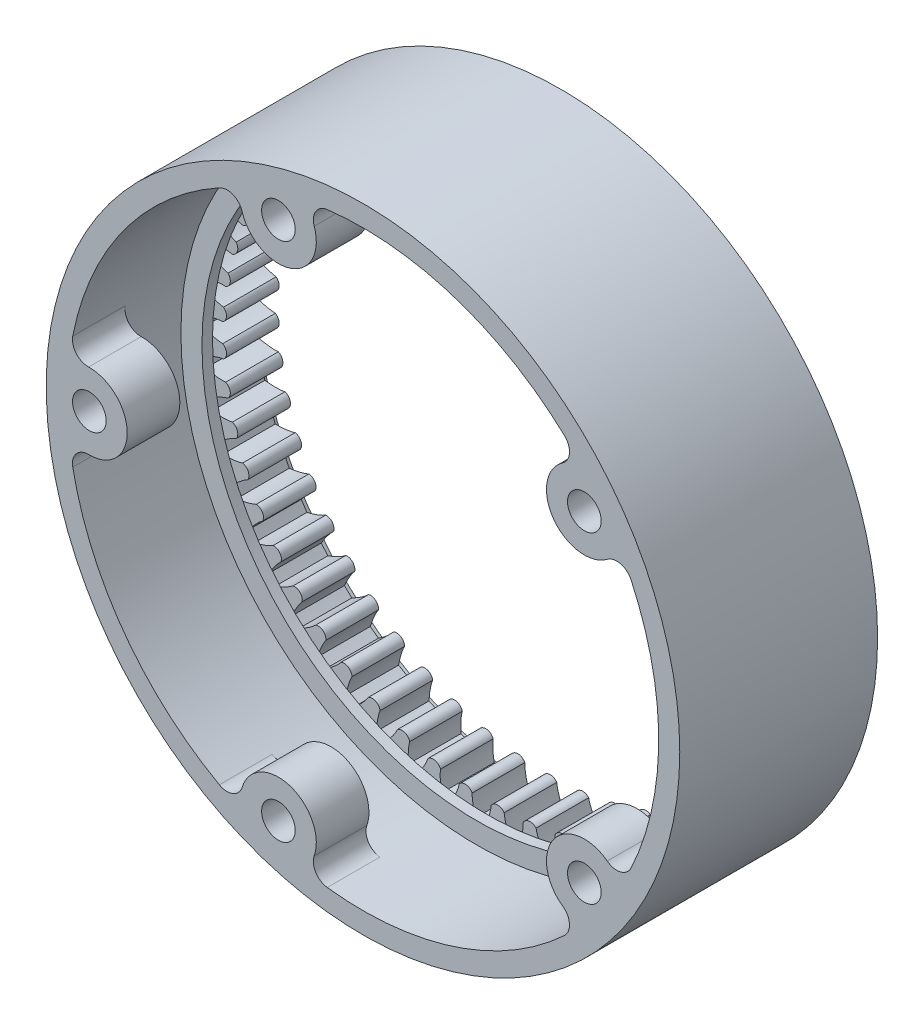
from build123d import *
from build123d.topology import SkipClean

# Parameters (mm, degrees)
BOSS_EXTRUDE1_DEPTH      = 1.9
BOSS_EXTRUDE2_DEPTH      = 12.9
SKETCH3_R                = 29.000000007
CUT_EXTRUDE1_DEPTH       = 1
CUT_EXTRUDE2_DEPTH       = 5
SKETCH5_R                = 28.100000003
CUT_EXTRUDE3_DEPTH       = 1
CUT_EXTRUDE4_START       = -12.9
CUT_EXTRUDE4_DEPTH       = 12.9
F_4_0_4_DIAMETER_HOLE1_D = 4
CUT_EXTRUDE5_DEPTH       = 56.8771868
CUT_EXTRUDE5_DEPTH_BACK  = 56.8771868
SKETCH11_R               = 2
BOSS_EXTRUDE3_START      = 4
SKETCH12_R               = 30.100000003
SKETCH12_R_2             = 28.100000003
BOSS_EXTRUDE3_DEPTH      = 4
BOSS_EXTRUDE5_START      = -5
SKETCH13_R               = 1.6
BOSS_EXTRUDE5_DEPTH      = 5


with BuildPart() as part:
    # Sketch1 → Boss-Extrude1 (new body)
    with BuildSketch(Plane.XY.offset(15.8)):
        with BuildLine():
            Line((3.999999971, 29.833035408), (3.999999971, 34.100000028))
            ThreePointArc((3.999999971, 34.100000028), (-2.9e-08, 38.100000028), (-4.000000029, 34.100000028))
            Line((-4.000000029, 34.100000028), (-4.000000029, 29.833035408))
            ThreePointArc((-4.000000029, 29.833035408), (-21.283914146, 21.283914141), (-29.833035413, 4.000000025))
            Line((-29.833035413, 4.000000025), (-34.100000033, 4.000000025))
            ThreePointArc((-34.100000033, 4.000000025), (-38.100000033, 2.5e-08), (-34.100000033, -3.999999975))
            Line((-34.100000033, -3.999999975), (-29.833035413, -3.999999975))
            ThreePointArc((-29.833035413, -3.999999975), (-21.283914146, -21.283914092), (-4.000000029, -29.833035359))
            Line((-4.000000029, -29.833035359), (-4.000000029, -34.099999979))
            ThreePointArc((-4.000000029, -34.099999979), (-2.9e-08, -38.099999979), (3.999999971, -34.099999979))
            Line((3.999999971, -34.099999979), (3.999999971, -29.833035359))
            ThreePointArc((3.999999971, -29.833035359), (21.283914087, -21.283914092), (29.833035354, -3.999999975))
            Line((29.833035354, -3.999999975), (34.099999974, -3.999999975))
            ThreePointArc((34.099999974, -3.999999975), (38.099999974, 2.5e-08), (34.099999974, 4.000000025))
            Line((34.099999974, 4.000000025), (29.833035354, 4.000000025))
            ThreePointArc((29.833035354, 4.000000025), (21.283914087, 21.283914141), (3.999999971, 29.833035408))
        make_face()
    extrude(amount=-BOSS_EXTRUDE1_DEPTH)

    # Sketch2 → Boss-Extrude2 (add)
    with BuildSketch(Plane(origin=(0, 0, 13.9), x_dir=(-1, 0, 0), z_dir=(0, 0, -1))):
        with BuildLine():
            Line((-29.833035354, -3.999999975), (-34.099999974, -3.999999975))
            ThreePointArc((-34.099999974, -3.999999975), (-38.099999974, 2.5e-08), (-34.099999974, 4.000000025))
            Line((-34.099999974, 4.000000025), (-29.833035354, 4.000000025))
            ThreePointArc((-29.833035354, 4.000000025), (30.100000033, 2.5e-08), (-29.833035354, -3.999999975))
        make_face()
    extrude(amount=BOSS_EXTRUDE2_DEPTH)

    # Sketch3 → Cut-Extrude1 (cut)
    with BuildSketch(Plane(origin=(0, 0, 1), x_dir=(-1, 0, 0), z_dir=(0, 0, -1))):
        with Locations((-1.9e-08, 5.3e-08)):
            Circle(SKETCH3_R)
    extrude(amount=-CUT_EXTRUDE1_DEPTH, mode=Mode.SUBTRACT)

    # Sketch4 → Cut-Extrude2 (cut)
    with BuildSketch(Plane(origin=(0, 0, 2), x_dir=(-1, 0, 0), z_dir=(0, 0, -1))):
        with BuildLine():
            ThreePointArc((-27.995776094, 0.484140924), (-27.999958724, 0.000192017), (-27.99577621, -0.483756892))
            add(Edge.make_bspline(
                [(-27.99577621, -0.483756892), (-26.869576859, -0.895866137), (-26.124303598, -0.904954601)],
                knots=[1.565757093, 1.565757093, 1.565757093, 2.51489562, 2.51489562, 2.51489562], degree=2, weights=[1, 0.889489632, 1]))
            ThreePointArc((-26.124303598, -0.904954601), (-25.767762214, -1.500605385), (-26.052706637, -2.13363642))
            add(Edge.make_bspline(
                [(-26.052706637, -2.13363642), (-26.791892303, -2.229001641), (-27.862661821, -2.76924741)],
                knots=[3.768507227, 3.768507227, 3.768507227, 4.724135584, 4.724135584, 4.724135584], degree=2, weights=[1, 0.88800217, 1]))
            ThreePointArc((-27.862661821, -2.76924741), (-27.810633131, -3.250409602), (-27.750295859, -3.730600661))
            add(Edge.make_bspline(
                [(-27.750295859, -3.730600661), (-26.583868502, -4.009179606), (-25.842579405, -3.931685672)],
                knots=[1.565757092, 1.565757092, 1.565757092, 2.51489562, 2.51489562, 2.51489562], degree=2, weights=[1, 0.889489631, 1]))
            ThreePointArc((-25.842579405, -3.931685672), (-25.419297991, -4.481916951), (-25.628825304, -5.143747685))
            add(Edge.make_bspline(
                [(-25.628825304, -5.143747685), (-26.351941636, -5.324282298), (-27.352752288, -5.985183873)],
                knots=[3.768507227, 3.768507227, 3.768507227, 4.724135579, 4.724135579, 4.724135579], degree=2, weights=[1, 0.888002171, 1]))
            ThreePointArc((-27.352752288, -5.985183873), (-27.245215876, -6.457052456), (-27.129539803, -6.926991905))
            add(Edge.make_bspline(
                [(-27.129539803, -6.926991905), (-25.938658369, -7.068273248), (-25.2113781, -6.905244889)],
                knots=[1.565757093, 1.565757093, 1.565757093, 2.51489562, 2.51489562, 2.51489562], degree=2, weights=[1, 0.889489631, 1]))
            ThreePointArc((-25.2113781, -6.905244889), (-24.727080812, -7.402615728), (-24.858357517, -8.084296036))
            add(Edge.make_bspline(
                [(-24.858357517, -8.084296036), (-25.555625605, -8.347558621), (-26.472943144, -9.12017844)],
                knots=[3.768507227, 3.768507227, 3.768507227, 4.724135583, 4.724135583, 4.724135583], degree=2, weights=[1, 0.88800217, 1]))
            ThreePointArc((-26.472943144, -9.12017844), (-26.311353256, -9.576372201), (-26.141902703, -10.029704916))
            add(Edge.make_bspline(
                [(-26.141902703, -10.029704916), (-24.94267182, -10.031778069), (-24.239235598, -9.785419964)],
                knots=[1.565757095, 1.565757095, 1.565757095, 2.51489562, 2.51489562, 2.51489562], degree=2, weights=[1, 0.889489632, 1]))
            ThreePointArc((-24.239235598, -9.785419964), (-23.700471724, -10.223204275), (-23.75172253, -10.9155156))
            add(Edge.make_bspline(
                [(-23.75172253, -10.9155156), (-24.41371302, -11.257945982), (-25.235132299, -12.131835688)],
                knots=[0.626914573, 0.626914573, 0.626914573, 1.582542924, 1.582542924, 1.582542924], degree=2, weights=[1, 0.888002171, 1]))
            ThreePointArc((-25.235132299, -12.131835688), (-25.021674161, -12.56618539), (-24.800740656, -12.996780823))
            add(Edge.make_bspline(
                [(-24.800740656, -12.996780823), (-23.609377865, -12.85961775), (-22.939298457, -12.533261469)],
                knots=[1.565757092, 1.565757092, 1.565757092, 2.51489562, 2.51489562, 2.51489562], degree=2, weights=[1, 0.889489631, 1]))
            ThreePointArc((-22.939298457, -12.533261469), (-22.353353856, -12.905538972), (-22.323885683, -13.59911899))
            add(Edge.make_bspline(
                [(-22.323885683, -13.59911899), (-22.941646289, -14.016086385), (-23.656059022, -14.97942812)],
                knots=[0.626914573, 0.626914573, 0.626914573, 1.582542928, 1.582542928, 1.582542928], degree=2, weights=[1, 0.88800217, 1]))
            ThreePointArc((-23.656059022, -14.97942812), (-23.393619289, -15.386059927), (-23.124190579, -15.788095013))
            add(Edge.make_bspline(
                [(-23.124190579, -15.788095013), (-21.956807018, -15.51355061), (-21.329146099, -15.111609563)],
                knots=[1.565757095, 1.565757095, 1.565757095, 2.51489562, 2.51489562, 2.51489562], degree=2, weights=[1, 0.889489632, 1]))
            ThreePointArc((-21.329146099, -15.111609563), (-20.703944664, -15.413345841), (-20.59415602, -16.098815074))
            add(Edge.make_bspline(
                [(-20.59415602, -16.098815074), (-21.159332589, -16.584680714), (-21.75707757, -17.624446933)],
                knots=[0.626914573, 0.626914573, 0.626914573, 1.582542928, 1.582542928, 1.582542928], degree=2, weights=[1, 0.88800217, 1]))
            ThreePointArc((-21.75707757, -17.624446933), (-21.449205289, -17.997861847), (-21.134924934, -18.365899752))
            add(Edge.make_bspline(
                [(-21.134924934, -18.365899752), (-20.007307463, -17.95768676), (-19.43055307, -17.485596509)],
                knots=[1.565757093, 1.565757093, 1.565757093, 2.51489562, 2.51489562, 2.51489562], degree=2, weights=[1, 0.889489632, 1]))
            ThreePointArc((-19.43055307, -17.485596509), (-18.77454958, -17.712711099), (-18.585925166, -18.38079975))
            add(Edge.make_bspline(
                [(-18.585925166, -18.38079975), (-19.090874656, -18.928993135), (-19.563868409, -20.031122783)],
                knots=[0.626914573, 0.626914573, 0.626914573, 1.582542929, 1.582542929, 1.582542929], degree=2, weights=[1, 0.88800217, 1]))
            ThreePointArc((-19.563868409, -20.031122783), (-19.214727024, -20.36627101), (-18.859845128, -20.695334651))
            add(Edge.make_bspline(
                [(-18.859845128, -20.695334651), (-17.787242838, -20.158973451), (-17.269194585, -19.623118207)],
                knots=[1.565757093, 1.565757093, 1.565757093, 2.51489562, 2.51489562, 2.51489562], degree=2, weights=[1, 0.889489632, 1]))
            ThreePointArc((-17.269194585, -19.623118207), (-16.591260361, -19.772539773), (-16.326351, -20.414213089))
            add(Edge.make_bspline(
                [(-16.326351, -20.414213089), (-16.764244834, -21.017320845), (-17.10609093, -22.16690951)],
                knots=[0.626914573, 0.626914573, 0.626914573, 1.582542926, 1.582542926, 1.582542926], degree=2, weights=[1, 0.888002171, 1]))
            ThreePointArc((-17.10609093, -22.16690951), (-16.72040198, -22.459258743), (-16.329717711, -22.744898101))
            add(Edge.make_bspline(
                [(-16.329717711, -22.744898101), (-15.326635709, -22.087642058), (-14.874299309, -21.495268344)],
                knots=[1.565757092, 1.565757092, 1.565757092, 2.51489562, 2.51489562, 2.51489562], degree=2, weights=[1, 0.889489631, 1]))
            ThreePointArc((-14.874299309, -21.495268344), (-14.183602249, -21.564976214), (-13.845990385, -22.171556666))
            add(Edge.make_bspline(
                [(-13.845990385, -22.171556666), (-14.210906801, -22.821422793), (-14.416982357, -24.002924261)],
                knots=[0.626914573, 0.626914573, 0.626914573, 1.582542934, 1.582542934, 1.582542934], degree=2, weights=[1, 0.888002169, 1]))
            ThreePointArc((-14.416982357, -24.002924261), (-13.999961624, -24.248520979), (-13.578758317, -24.48687327))
            add(Edge.make_bspline(
                [(-13.578758317, -24.48687327), (-12.658761565, -23.717610645), (-12.278254093, -23.076729299)],
                knots=[1.565757096, 1.565757096, 1.565757096, 2.51489562, 2.51489562, 2.51489562], degree=2, weights=[1, 0.889489632, 1]))
            ThreePointArc((-12.278254093, -23.076729299), (-11.58413469, -23.065780795), (-11.178385944, -23.629065422))
            add(Edge.make_bspline(
                [(-11.178385944, -23.629065422), (-11.465390074, -24.316901597), (-11.532908272, -25.514338086)],
                knots=[0.626914573, 0.626914573, 0.626914573, 1.582542934, 1.582542934, 1.582542934], degree=2, weights=[1, 0.888002169, 1]))
            ThreePointArc((-11.532908272, -25.514338086), (-11.090195244, -25.709861015), (-10.644168951, -25.897702934))
            add(Edge.make_bspline(
                [(-10.644168951, -25.897702934), (-9.819698829, -25.026836683), (-9.516165995, -24.346114526)],
                knots=[4.707349745, 4.707349745, 4.707349745, 5.656488273, 5.656488273, 5.656488273], degree=2, weights=[1, 0.889489631, 1]))
            ThreePointArc((-9.516165995, -24.346114526), (-8.828011023, -24.254657708), (-8.359612451, -24.767029051))
            add(Edge.make_bspline(
                [(-8.359612451, -24.767029051), (-8.564823055, -25.48353347), (-8.492870828, -26.680711706)],
                knots=[0.626914573, 0.626914573, 0.626914573, 1.582542929, 1.582542929, 1.582542929], degree=2, weights=[1, 0.88800217, 1]))
            ThreePointArc((-8.492870828, -26.680711706), (-8.030452441, -26.823516733), (-7.565634903, -26.95830804))
            add(Edge.make_bspline(
                [(-7.565634903, -26.95830804), (-6.847840953, -25.997615136), (-6.625387518, -25.286257768)],
                knots=[4.707349744, 4.707349744, 4.707349744, 5.656488273, 5.656488273, 5.656488273], degree=2, weights=[1, 0.889489631, 1]))
            ThreePointArc((-6.625387518, -25.286257768), (-5.952503092, -25.115529432), (-5.427788982, -25.570058548))
            add(Edge.make_bspline(
                [(-5.427788982, -25.570058548), (-5.548430939, -26.305541718), (-5.337981318, -27.486271919)],
                knots=[0.626914573, 0.626914573, 0.626914573, 1.582542929, 1.582542929, 1.582542929], degree=2, weights=[1, 0.88800217, 1]))
            ThreePointArc((-5.337981318, -27.486271919), (-4.862110986, -27.574427852), (-4.384788062, -27.654345725))
            add(Edge.make_bspline(
                [(-4.384788062, -27.654345725), (-3.783377217, -26.616817891), (-3.645011483, -25.8844452)],
                knots=[4.707349746, 4.707349746, 4.707349746, 5.656488273, 5.656488273, 5.656488273], degree=2, weights=[1, 0.889489631, 1]))
            ThreePointArc((-3.645011483, -25.8844452), (-2.996497211, -25.636754154), (-2.422563419, -26.027294316))
            add(Edge.make_bspline(
                [(-2.422563419, -26.027294316), (-2.457005255, -26.771810088), (-2.110904208, -27.920124905)],
                knots=[0.626914573, 0.626914573, 0.626914573, 1.582542929, 1.582542929, 1.582542929], degree=2, weights=[1, 0.88800217, 1]))
            ThreePointArc((-2.110904208, -27.920124905), (-1.628017263, -27.952439585), (-1.144643927, -27.976403273))
            add(Edge.make_bspline(
                [(-1.144643927, -27.976403273), (-0.667749236, -26.876071293), (-0.615342362, -26.132587362)],
                knots=[4.707349744, 4.707349744, 4.707349744, 5.656488273, 5.656488273, 5.656488273], degree=2, weights=[1, 0.889489631, 1]))
            ThreePointArc((-0.615342362, -26.132587362), (3.1714e-05, -25.811283203), (0.615423716, -26.132553026))
            add(Edge.make_bspline(
                [(0.615423716, -26.132553026), (0.667647769, -26.876033102), (1.144719818, -27.976403545)],
                knots=[0.626914573, 0.626914573, 0.626914573, 1.582542933, 1.582542933, 1.582542933], degree=2, weights=[1, 0.888002169, 1]))
            ThreePointArc((1.144719818, -27.976403545), (1.62809316, -27.952439972), (2.110980112, -27.920125407))
            add(Edge.make_bspline(
                [(2.110980112, -27.920125407), (2.456909466, -26.771869384), (2.422648768, -26.027328559)],
                knots=[4.707349743, 4.707349743, 4.707349743, 5.656488273, 5.656488273, 5.656488273], degree=2, weights=[1, 0.889489631, 1]))
            ThreePointArc((2.422648768, -26.027328559), (2.996560767, -25.636756374), (3.645088859, -25.884411235))
            add(Edge.make_bspline(
                [(3.645088859, -25.884411235), (3.783272561, -26.616801322), (4.38486403, -27.654346769)],
                knots=[3.768507227, 3.768507227, 3.768507227, 4.724135582, 4.724135582, 4.724135582], degree=2, weights=[1, 0.88800217, 1]))
            ThreePointArc((4.38486403, -27.654346769), (4.862186973, -27.574429009), (5.338057325, -27.48627319))
            add(Edge.make_bspline(
                [(5.338057325, -27.48627319), (5.54834324, -26.305621317), (5.427878286, -25.570092234)],
                knots=[4.707349746, 4.707349746, 4.707349746, 5.656488273, 5.656488273, 5.656488273], degree=2, weights=[1, 0.889489631, 1]))
            ThreePointArc((5.427878286, -25.570092234), (5.952567035, -25.115533842), (6.625460986, -25.286224633))
            add(Edge.make_bspline(
                [(6.625460986, -25.286224633), (6.847735639, -25.997620412), (7.565711036, -26.958309842)],
                knots=[0.626914573, 0.626914573, 0.626914573, 1.582542931, 1.582542931, 1.582542931], degree=2, weights=[1, 0.88800217, 1]))
            ThreePointArc((7.565711036, -26.958309842), (8.030528607, -26.823518645), (8.492947027, -26.680713729))
            add(Edge.make_bspline(
                [(8.492947027, -26.680713729), (8.564745748, -25.483632296), (8.35970562, -24.767061725)],
                knots=[4.707349745, 4.707349745, 4.707349745, 5.656488273, 5.656488273, 5.656488273], degree=2, weights=[1, 0.889489631, 1]))
            ThreePointArc((8.35970562, -24.767061725), (8.828075603, -24.254664248), (9.516235677, -24.34608267))
            add(Edge.make_bspline(
                [(9.516235677, -24.34608267), (9.819595397, -25.026863733), (10.644245338, -25.897705468)],
                knots=[0.626914573, 0.626914573, 0.626914573, 1.582542925, 1.582542925, 1.582542925], degree=2, weights=[1, 0.888002171, 1]))
            ThreePointArc((10.644245338, -25.897705468), (11.090271675, -25.709863655), (11.532984749, -25.514340832))
            add(Edge.make_bspline(
                [(11.532984749, -25.514340832), (11.46532532, -24.317018313), (11.178482835, -23.629096642)],
                knots=[4.70734974, 4.70734974, 4.70734974, 5.656488273, 5.656488273, 5.656488273], degree=2, weights=[1, 0.88948963, 1]))
            ThreePointArc((11.178482835, -23.629096642), (11.584200151, -23.065789377), (12.278320164, -23.076699152))
            add(Edge.make_bspline(
                [(12.278320164, -23.076699152), (12.658662531, -23.717659103), (13.578835039, -24.486876503)],
                knots=[3.768507227, 3.768507227, 3.768507227, 4.72413558, 4.72413558, 4.72413558], degree=2, weights=[1, 0.888002171, 1]))
            ThreePointArc((13.578835039, -24.486876503), (14.000038402, -24.248524312), (14.417059194, -24.002927694))
            add(Edge.make_bspline(
                [(14.417059194, -24.002927694), (14.210856594, -22.821555821), (13.846090803, -22.17158601)],
                knots=[4.707349741, 4.707349741, 4.707349741, 5.656488273, 5.656488273, 5.656488273], degree=2, weights=[1, 0.88948963, 1]))
            ThreePointArc((13.846090803, -22.17158601), (14.183668822, -21.564986722), (14.874361991, -21.495240314))
            add(Edge.make_bspline(
                [(14.874361991, -21.495240314), (15.326543528, -22.087711269), (16.329794848, -22.744901989)],
                knots=[0.626914573, 0.626914573, 0.626914573, 1.582542936, 1.582542936, 1.582542936], degree=2, weights=[1, 0.888002169, 1]))
            ThreePointArc((16.329794848, -22.744901989), (16.720479184, -22.459262724), (17.106168203, -22.166913583))
            add(Edge.make_bspline(
                [(17.106168203, -22.166913583), (16.764210968, -21.017468385), (16.326454703, -20.414240161)],
                knots=[4.707349746, 4.707349746, 4.707349746, 5.656488273, 5.656488273, 5.656488273], degree=2, weights=[1, 0.889489631, 1]))
            ThreePointArc((16.326454703, -20.414240161), (16.591328262, -19.772552065), (17.269254147, -19.623092674))
            add(Edge.make_bspline(
                [(17.269254147, -19.623092674), (17.787159874, -20.15906248), (18.859922752, -20.695339142)],
                knots=[0.626914573, 0.626914573, 0.626914573, 1.582542928, 1.582542928, 1.582542928], degree=2, weights=[1, 0.88800217, 1]))
            ThreePointArc((18.859922752, -20.695339142), (19.214804726, -20.366275585), (19.56394619, -20.031127442))
            add(Edge.make_bspline(
                [(19.56394619, -20.031127442), (19.090858705, -18.929153193), (18.586031869, -18.380824183)],
                knots=[4.707349743, 4.707349743, 4.707349743, 5.656488273, 5.656488273, 5.656488273], degree=2, weights=[1, 0.889489631, 1]))
            ThreePointArc((18.586031869, -18.380824183), (18.774619006, -17.712725009), (19.430609823, -17.485573817))
            add(Edge.make_bspline(
                [(19.430609823, -17.485573817), (20.007235953, -17.957794402), (21.135003113, -18.365904784)],
                knots=[0.626914573, 0.626914573, 0.626914573, 1.582542934, 1.582542934, 1.582542934], degree=2, weights=[1, 0.888002169, 1]))
            ThreePointArc((21.135003113, -18.365904784), (21.449283555, -17.997866955), (21.757155925, -17.624452114))
            add(Edge.make_bspline(
                [(21.757155925, -17.624452114), (21.159335886, -16.584851126), (20.594265396, -16.098836538)],
                knots=[4.707349744, 4.707349744, 4.707349744, 5.656488273, 5.656488273, 5.656488273], degree=2, weights=[1, 0.889489631, 1]))
            ThreePointArc((20.594265396, -16.098836538), (20.704015794, -15.413361181), (21.329200391, -15.111590019))
            add(Edge.make_bspline(
                [(21.329200391, -15.111590019), (21.956749046, -15.51367541), (23.124269372, -15.788100519)],
                knots=[0.626914573, 0.626914573, 0.626914573, 1.582542934, 1.582542934, 1.582542934], degree=2, weights=[1, 0.888002169, 1]))
            ThreePointArc((23.124269372, -15.788100519), (23.393698177, -15.386065498), (23.656138007, -14.979433754))
            add(Edge.make_bspline(
                [(23.656138007, -14.979433754), (22.941669905, -14.016264846), (22.323997369, -13.599137195)],
                knots=[4.707349742, 4.707349742, 4.707349742, 5.656488273, 5.656488273, 5.656488273], degree=2, weights=[1, 0.889489631, 1]))
            ThreePointArc((22.323997369, -13.599137195), (22.353426843, -12.905555534), (22.939350672, -12.533245339))
            add(Edge.make_bspline(
                [(22.939350672, -12.533245339), (23.609335332, -12.859758019), (24.800820114, -12.996786728)],
                knots=[0.626914573, 0.626914573, 0.626914573, 1.582542928, 1.582542928, 1.582542928], degree=2, weights=[1, 0.88800217, 1]))
            ThreePointArc((24.800820114, -12.996786728), (25.02175372, -12.566191349), (25.235211962, -12.131841699))
            add(Edge.make_bspline(
                [(25.235211962, -12.131841699), (24.413757752, -11.258130078), (23.751836133, -10.9155303)],
                knots=[4.707349744, 4.707349744, 4.707349744, 5.656488273, 5.656488273, 5.656488273], degree=2, weights=[1, 0.889489631, 1]))
            ThreePointArc((23.751836133, -10.9155303), (23.700546699, -10.223221836), (24.239286145, -9.785407464))
            add(Edge.make_bspline(
                [(24.239286145, -9.785407464), (24.942646417, -10.031931912), (26.141982867, -10.02971114)],
                knots=[0.626914573, 0.626914573, 0.626914573, 1.582542927, 1.582542927, 1.582542927], degree=2, weights=[1, 0.888002171, 1]))
            ThreePointArc((26.141982867, -10.02971114), (26.311433527, -9.576378467), (26.473023523, -9.120184745))
            add(Edge.make_bspline(
                [(26.473023523, -9.120184745), (25.555691965, -8.347745863), (24.858472616, -8.084307032)],
                knots=[4.707349744, 4.707349744, 4.707349744, 5.656488273, 5.656488273, 5.656488273], degree=2, weights=[1, 0.889489631, 1]))
            ThreePointArc((24.858472616, -8.084307032), (24.727157876, -7.40263405), (25.211427413, -6.90523619))
            add(Edge.make_bspline(
                [(25.211427413, -6.90523619), (25.938651555, -7.068438584), (27.129620705, -6.926998365)],
                knots=[0.626914573, 0.626914573, 0.626914573, 1.58254293, 1.58254293, 1.58254293], degree=2, weights=[1, 0.88800217, 1]))
            ThreePointArc((27.129620705, -6.926998365), (27.245275398, -6.457149626), (27.352793571, -5.985372466))
            add(Edge.make_bspline(
                [(27.352793571, -5.985372466), (26.351997667, -5.324659939), (25.628915728, -5.143946223)],
                knots=[4.707356987, 4.707356987, 4.707356987, 5.656488273, 5.656488273, 5.656488273], degree=2, weights=[1, 0.889491286, 1]))
            ThreePointArc((25.628915728, -5.143946223), (25.419351488, -4.482127181), (25.8426022, -3.931872286))
            add(Edge.make_bspline(
                [(25.8426022, -3.931872286), (26.583855755, -4.009545593), (27.75035179, -3.730798663)],
                knots=[0.626914573, 0.626914573, 0.626914573, 1.582542928, 1.582542928, 1.582542928], degree=2, weights=[1, 0.88800217, 1]))
            ThreePointArc((27.75035179, -3.730798663), (27.810703699, -3.250512131), (27.862743714, -2.769254047))
            add(Edge.make_bspline(
                [(27.862743714, -2.769254047), (26.792002281, -2.229187571), (26.052823394, -2.133639615)],
                knots=[4.707349743, 4.707349743, 4.707349743, 5.656488273, 5.656488273, 5.656488273], degree=2, weights=[1, 0.889489631, 1]))
            ThreePointArc((26.052823394, -2.133639615), (25.767843651, -1.500624479), (26.1243518, -0.904953802))
            add(Edge.make_bspline(
                [(26.1243518, -0.904953802), (26.869610583, -0.896047625), (27.995858647, -0.483763558)],
                knots=[0.626914573, 0.626914573, 0.626914573, 1.58254293, 1.58254293, 1.58254293], degree=2, weights=[1, 0.88800217, 1]))
            ThreePointArc((27.995858647, -0.483763558), (28.000041276, 0.000185348), (27.995858761, 0.484134255))
            add(Edge.make_bspline(
                [(27.995858761, 0.484134255), (26.869659407, 0.896243501), (26.124386144, 0.905331966)],
                knots=[1.565757091, 1.565757091, 1.565757091, 2.51489562, 2.51489562, 2.51489562], degree=2, weights=[1, 0.889489631, 1]))
            ThreePointArc((26.124386144, 0.905331966), (25.76784476, 1.50098275), (26.052789183, 2.134013785))
            add(Edge.make_bspline(
                [(26.052789183, 2.134013785), (26.791974849, 2.229379006), (27.862744367, 2.769624775)],
                knots=[0.626914573, 0.626914573, 0.626914573, 1.58254293, 1.58254293, 1.58254293], degree=2, weights=[1, 0.88800217, 1]))
            ThreePointArc((27.862744367, 2.769624775), (27.810715676, 3.250786965), (27.750378403, 3.730978023))
            add(Edge.make_bspline(
                [(27.750378403, 3.730978023), (26.583951043, 4.009556969), (25.842661945, 3.932063035)],
                knots=[4.707349744, 4.707349744, 4.707349744, 5.656488273, 5.656488273, 5.656488273], degree=2, weights=[1, 0.889489631, 1]))
            ThreePointArc((25.842661945, 3.932063035), (25.419380531, 4.482294314), (25.628907844, 5.144125048))
            add(Edge.make_bspline(
                [(25.628907844, 5.144125048), (26.352024175, 5.324659661), (27.352834827, 5.985561235)],
                knots=[0.626914573, 0.626914573, 0.626914573, 1.582542926, 1.582542926, 1.582542926], degree=2, weights=[1, 0.888002171, 1]))
            ThreePointArc((27.352834827, 5.985561235), (27.245298415, 6.457429817), (27.129622341, 6.927369264))
            add(Edge.make_bspline(
                [(27.129622341, 6.927369264), (25.938740904, 7.068650608), (25.211460634, 6.905622249)],
                knots=[4.707349744, 4.707349744, 4.707349744, 5.656488273, 5.656488273, 5.656488273], degree=2, weights=[1, 0.889489631, 1]))
            ThreePointArc((25.211460634, 6.905622249), (24.727163345, 7.402993087), (24.858440051, 8.084673395))
            add(Edge.make_bspline(
                [(24.858440051, 8.084673395), (25.555708139, 8.34793598), (26.473025677, 9.120555799)],
                knots=[0.626914573, 0.626914573, 0.626914573, 1.582542929, 1.582542929, 1.582542929], degree=2, weights=[1, 0.88800217, 1]))
            ThreePointArc((26.473025677, 9.120555799), (26.311435789, 9.576749558), (26.141985236, 10.03008227))
            add(Edge.make_bspline(
                [(26.141985236, 10.03008227), (24.942754351, 10.032155424), (24.239318127, 9.785797318)],
                knots=[4.707349746, 4.707349746, 4.707349746, 5.656488273, 5.656488273, 5.656488273], degree=2, weights=[1, 0.889489631, 1]))
            ThreePointArc((24.239318127, 9.785797318), (23.700554253, 10.22358163), (23.751805059, 10.915892954))
            add(Edge.make_bspline(
                [(23.751805059, 10.915892954), (24.413795549, 11.258323336), (25.235214828, 12.132213043)],
                knots=[3.768507227, 3.768507227, 3.768507227, 4.724135578, 4.724135578, 4.724135578], degree=2, weights=[1, 0.888002171, 1]))
            ThreePointArc((25.235214828, 12.132213043), (25.02175669, 12.566562742), (24.800823186, 12.997158172))
            add(Edge.make_bspline(
                [(24.800823186, 12.997158172), (23.609460392, 12.859995099), (22.939380982, 12.533638818)],
                knots=[4.707349743, 4.707349743, 4.707349743, 5.656488273, 5.656488273, 5.656488273], degree=2, weights=[1, 0.889489631, 1]))
            ThreePointArc((22.939380982, 12.533638818), (22.353436381, 12.90591632), (22.323968208, 13.599496339))
            add(Edge.make_bspline(
                [(22.323968208, 13.599496339), (22.941728814, 14.016463734), (23.656141547, 14.979805469)],
                knots=[3.768507227, 3.768507227, 3.768507227, 4.724135582, 4.724135582, 4.724135582], degree=2, weights=[1, 0.88800217, 1]))
            ThreePointArc((23.656141547, 14.979805469), (23.393701815, 15.386437273), (23.124273106, 15.788472356))
            add(Edge.make_bspline(
                [(23.124273106, 15.788472356), (21.956889542, 15.513927953), (21.329228621, 15.111986904)],
                knots=[1.565757094, 1.565757094, 1.565757094, 2.51489562, 2.51489562, 2.51489562], degree=2, weights=[1, 0.889489632, 1]))
            ThreePointArc((21.329228621, 15.111986904), (20.704027187, 15.413723183), (20.594238542, 16.099192416))
            add(Edge.make_bspline(
                [(20.594238542, 16.099192416), (21.159415112, 16.585058055), (21.757160093, 17.624824274)],
                knots=[3.768507227, 3.768507227, 3.768507227, 4.724135582, 4.724135582, 4.724135582], degree=2, weights=[1, 0.88800217, 1]))
            ThreePointArc((21.757160093, 17.624824274), (21.449287813, 17.998239186), (21.13500746, 18.366277088))
            add(Edge.make_bspline(
                [(21.13500746, 18.366277088), (20.007389986, 17.958064096), (19.430635592, 17.485973844)],
                knots=[4.707349745, 4.707349745, 4.707349745, 5.656488273, 5.656488273, 5.656488273], degree=2, weights=[1, 0.889489631, 1]))
            ThreePointArc((19.430635592, 17.485973844), (18.774632102, 17.713088434), (18.586007688, 18.381177085))
            add(Edge.make_bspline(
                [(18.586007688, 18.381177085), (19.090957178, 18.92937047), (19.563950931, 20.031500118)],
                knots=[3.768507227, 3.768507227, 3.768507227, 4.724135583, 4.724135583, 4.724135583], degree=2, weights=[1, 0.88800217, 1]))
            ThreePointArc((19.563950931, 20.031500118), (19.214809548, 20.366648342), (18.859927654, 20.695711981))
            add(Edge.make_bspline(
                [(18.859927654, 20.695711981), (17.787325362, 20.15935078), (17.269277108, 19.623495536)],
                knots=[4.707349744, 4.707349744, 4.707349744, 5.656488273, 5.656488273, 5.656488273], degree=2, weights=[1, 0.889489631, 1]))
            ThreePointArc((17.269277108, 19.623495536), (16.591342884, 19.772917101), (16.326433523, 20.414590418))
            add(Edge.make_bspline(
                [(16.326433523, 20.414590418), (16.764327358, 21.017698173), (17.106173453, 22.167286838)],
                knots=[3.768507227, 3.768507227, 3.768507227, 4.724135588, 4.724135588, 4.724135588], degree=2, weights=[1, 0.888002169, 1]))
            ThreePointArc((17.106173453, 22.167286838), (16.720484505, 22.459636069), (16.329800239, 22.745275424))
            add(Edge.make_bspline(
                [(16.329800239, 22.745275424), (15.326718235, 22.08801938), (14.874381835, 21.495645666)],
                knots=[4.707349744, 4.707349744, 4.707349744, 5.656488273, 5.656488273, 5.656488273], degree=2, weights=[1, 0.889489631, 1]))
            ThreePointArc((14.874381835, 21.495645666), (14.183684775, 21.565353536), (13.846072911, 22.171933988))
            add(Edge.make_bspline(
                [(13.846072911, 22.171933988), (14.210989327, 22.821800115), (14.417064883, 24.003301583)],
                knots=[3.768507227, 3.768507227, 3.768507227, 4.724135587, 4.724135587, 4.724135587], degree=2, weights=[1, 0.888002169, 1]))
            ThreePointArc((14.417064883, 24.003301583), (14.000044152, 24.248898299), (13.578840848, 24.487250588))
            add(Edge.make_bspline(
                [(13.578840848, 24.487250588), (12.658844095, 23.717987961), (12.278336623, 23.077106615)],
                knots=[4.707349748, 4.707349748, 4.707349748, 5.656488273, 5.656488273, 5.656488273], degree=2, weights=[1, 0.889489632, 1]))
            ThreePointArc((12.278336623, 23.077106615), (11.58421722, 23.066158111), (11.178468474, 23.629442738))
            add(Edge.make_bspline(
                [(11.178468474, 23.629442738), (11.465472603, 24.317278913), (11.532990802, 25.514715402)],
                knots=[3.768507227, 3.768507227, 3.768507227, 4.724135588, 4.724135588, 4.724135588], degree=2, weights=[1, 0.888002169, 1]))
            ThreePointArc((11.532990802, 25.514715402), (11.090277777, 25.710238329), (10.644251487, 25.898080246))
            add(Edge.make_bspline(
                [(10.644251487, 25.898080246), (9.819781364, 25.027213995), (9.51624853, 24.346491838)],
                knots=[1.56575709, 1.56575709, 1.56575709, 2.51489562, 2.51489562, 2.51489562], degree=2, weights=[1, 0.889489631, 1]))
            ThreePointArc((9.51624853, 24.346491838), (8.828093558, 24.25503502), (8.359694986, 24.767406362))
            add(Edge.make_bspline(
                [(8.359694986, 24.767406362), (8.56490559, 25.483910782), (8.492953363, 26.681089018)],
                knots=[3.768507227, 3.768507227, 3.768507227, 4.724135583, 4.724135583, 4.724135583], degree=2, weights=[1, 0.88800217, 1]))
            ThreePointArc((8.492953363, 26.681089018), (8.030534979, 26.823894044), (7.565717444, 26.958685349))
            add(Edge.make_bspline(
                [(7.565717444, 26.958685349), (6.847923494, 25.997992445), (6.625470059, 25.286635076)],
                knots=[1.56575709, 1.56575709, 1.56575709, 2.51489562, 2.51489562, 2.51489562], degree=2, weights=[1, 0.889489631, 1]))
            ThreePointArc((6.625470059, 25.286635076), (5.952585633, 25.11590674), (5.427871522, 25.570435856))
            add(Edge.make_bspline(
                [(5.427871522, 25.570435856), (5.54851348, 26.305919026), (5.338063858, 27.486649227)],
                knots=[3.768507227, 3.768507227, 3.768507227, 4.724135583, 4.724135583, 4.724135583], degree=2, weights=[1, 0.88800217, 1]))
            ThreePointArc((5.338063858, 27.486649227), (4.862193531, 27.574805159), (4.38487061, 27.654723032))
            add(Edge.make_bspline(
                [(4.38487061, 27.654723032), (3.783459764, 26.617195198), (3.64509403, 25.884822506)],
                knots=[1.565757092, 1.565757092, 1.565757092, 2.51489562, 2.51489562, 2.51489562], degree=2, weights=[1, 0.889489631, 1]))
            ThreePointArc((3.64509403, 25.884822506), (2.996579758, 25.63713146), (2.422645967, 26.027671623))
            add(Edge.make_bspline(
                [(2.422645967, 26.027671623), (2.457087802, 26.772187395), (2.110986756, 27.920502211)],
                knots=[3.768507227, 3.768507227, 3.768507227, 4.724135585, 4.724135585, 4.724135585], degree=2, weights=[1, 0.88800217, 1]))
            ThreePointArc((2.110986756, 27.920502211), (1.628099814, 27.952816891), (1.144726481, 27.976780579))
            add(Edge.make_bspline(
                [(1.144726481, 27.976780579), (0.66783179, 26.876448599), (0.615424916, 26.132964668)],
                knots=[1.565757089, 1.565757089, 1.565757089, 2.51489562, 2.51489562, 2.51489562], degree=2, weights=[1, 0.889489631, 1]))
            ThreePointArc((0.615424916, 26.132964668), (5.0841e-05, 25.811660509), (-0.615341161, 26.132930332))
            add(Edge.make_bspline(
                [(-0.615341161, 26.132930332), (-0.667565215, 26.876410408), (-1.144637263, 27.976780851)],
                knots=[3.768507227, 3.768507227, 3.768507227, 4.724135585, 4.724135585, 4.724135585], degree=2, weights=[1, 0.888002169, 1]))
            ThreePointArc((-1.144637263, 27.976780851), (-1.628010602, 27.952817279), (-2.110897552, 27.920502714))
            add(Edge.make_bspline(
                [(-2.110897552, 27.920502714), (-2.456826905, 26.772246692), (-2.422566206, 26.027705866)],
                knots=[1.565757092, 1.565757092, 1.565757092, 2.51489562, 2.51489562, 2.51489562], degree=2, weights=[1, 0.889489631, 1]))
            ThreePointArc((-2.422566206, 26.027705866), (-2.996478206, 25.637133681), (-3.645006298, 25.884788542))
            add(Edge.make_bspline(
                [(-3.645006298, 25.884788542), (-3.783189999, 26.617178629), (-4.384781469, 27.654724077)],
                knots=[3.768507227, 3.768507227, 3.768507227, 4.724135582, 4.724135582, 4.724135582], degree=2, weights=[1, 0.88800217, 1]))
            ThreePointArc((-4.384781469, 27.654724077), (-4.862104409, 27.574806317), (-5.337974758, 27.486650499))
            add(Edge.make_bspline(
                [(-5.337974758, 27.486650499), (-5.548260673, 26.305998627), (-5.427795719, 25.570469544)],
                knots=[1.565757093, 1.565757093, 1.565757093, 2.51489562, 2.51489562, 2.51489562], degree=2, weights=[1, 0.889489631, 1]))
            ThreePointArc((-5.427795719, 25.570469544), (-5.952484468, 25.115911152), (-6.625378419, 25.286601944))
            add(Edge.make_bspline(
                [(-6.625378419, 25.286601944), (-6.847653071, 25.997997722), (-7.565628469, 26.958687152)],
                knots=[3.768507227, 3.768507227, 3.768507227, 4.724135585, 4.724135585, 4.724135585], degree=2, weights=[1, 0.88800217, 1]))
            ThreePointArc((-7.565628469, 26.958687152), (-8.030446037, 26.823895957), (-8.492864455, 26.681091041))
            add(Edge.make_bspline(
                [(-8.492864455, 26.681091041), (-8.564663175, 25.48400961), (-8.359623048, 24.76743904)],
                knots=[1.565757092, 1.565757092, 1.565757092, 2.51489562, 2.51489562, 2.51489562], degree=2, weights=[1, 0.889489631, 1]))
            ThreePointArc((-8.359623048, 24.76743904), (-8.827993031, 24.255041563), (-9.516153105, 24.346459984))
            add(Edge.make_bspline(
                [(-9.516153105, 24.346459984), (-9.819512825, 25.027241047), (-10.644162765, 25.898082782)],
                knots=[3.768507227, 3.768507227, 3.768507227, 4.724135579, 4.724135579, 4.724135579], degree=2, weights=[1, 0.888002171, 1]))
            ThreePointArc((-10.644162765, 25.898082782), (-11.0901891, 25.710240971), (-11.532902171, 25.51471815))
            add(Edge.make_bspline(
                [(-11.532902171, 25.51471815), (-11.465242743, 24.317395632), (-11.178400257, 23.629473962)],
                knots=[1.565757088, 1.565757088, 1.565757088, 2.514895619, 2.514895619, 2.514895619], degree=2, weights=[1, 0.88948963, 1]))
            ThreePointArc((-11.178400257, 23.629473962), (-11.584117574, 23.066166697), (-12.278237587, 23.077076472))
            add(Edge.make_bspline(
                [(-12.278237587, 23.077076472), (-12.658579954, 23.718036423), (-13.578752461, 24.487253823)],
                knots=[0.626914573, 0.626914573, 0.626914573, 1.582542927, 1.582542927, 1.582542927], degree=2, weights=[1, 0.888002171, 1]))
            ThreePointArc((-13.578752461, 24.487253823), (-13.999955823, 24.248901634), (-14.416976613, 24.003305017))
            add(Edge.make_bspline(
                [(-14.416976613, 24.003305017), (-14.210774013, 22.821933146), (-13.846008223, 22.171963337)],
                knots=[1.565757088, 1.565757088, 1.565757088, 2.514895619, 2.514895619, 2.514895619], degree=2, weights=[1, 0.889489631, 1]))
            ThreePointArc((-13.846008223, 22.171963337), (-14.183586242, 21.565364049), (-14.874279411, 21.49561764))
            add(Edge.make_bspline(
                [(-14.874279411, 21.49561764), (-15.326460948, 22.088088595), (-16.329712267, 22.745279315)],
                knots=[3.768507227, 3.768507227, 3.768507227, 4.724135582, 4.724135582, 4.724135582], degree=2, weights=[1, 0.88800217, 1]))
            ThreePointArc((-16.329712267, 22.745279315), (-16.720396602, 22.459640052), (-17.10608562, 22.167290913))
            add(Edge.make_bspline(
                [(-17.10608562, 22.167290913), (-16.764128385, 21.017845717), (-16.326372122, 20.414617494)],
                knots=[1.565757095, 1.565757095, 1.565757095, 2.51489562, 2.51489562, 2.51489562], degree=2, weights=[1, 0.889489632, 1]))
            ThreePointArc((-16.326372122, 20.414617494), (-16.59124568, 19.772929398), (-17.269171565, 19.623470007))
            add(Edge.make_bspline(
                [(-17.269171565, 19.623470007), (-17.787077292, 20.159439813), (-18.859840171, 20.695716475)],
                knots=[3.768507227, 3.768507227, 3.768507227, 4.724135582, 4.724135582, 4.724135582], degree=2, weights=[1, 0.88800217, 1]))
            ThreePointArc((-18.859840171, 20.695716475), (-19.214722144, 20.36665292), (-19.563863607, 20.031504778))
            add(Edge.make_bspline(
                [(-19.563863607, 20.031504778), (-19.090776122, 18.929530532), (-18.585949288, 18.381201523)],
                knots=[1.565757092, 1.565757092, 1.565757092, 2.51489562, 2.51489562, 2.51489562], degree=2, weights=[1, 0.889489631, 1]))
            ThreePointArc((-18.585949288, 18.381201523), (-18.774536425, 17.713102348), (-19.430527241, 17.485951157))
            add(Edge.make_bspline(
                [(-19.430527241, 17.485951157), (-20.007153371, 17.958171742), (-21.134920532, 18.366282124)],
                knots=[3.768507227, 3.768507227, 3.768507227, 4.724135588, 4.724135588, 4.724135588], degree=2, weights=[1, 0.888002169, 1]))
            ThreePointArc((-21.134920532, 18.366282124), (-21.449200973, 17.998244296), (-21.757073343, 17.624829457))
            add(Edge.make_bspline(
                [(-21.757073343, 17.624829457), (-21.159253305, 16.585228471), (-20.594182816, 16.099213885)],
                knots=[1.565757093, 1.565757093, 1.565757093, 2.51489562, 2.51489562, 2.51489562], degree=2, weights=[1, 0.889489631, 1]))
            ThreePointArc((-20.594182816, 16.099213885), (-20.703933214, 15.413738528), (-21.329117812, 15.111967366))
            add(Edge.make_bspline(
                [(-21.329117812, 15.111967366), (-21.956666466, 15.514052756), (-23.124186792, 15.788477866)],
                knots=[3.768507227, 3.768507227, 3.768507227, 4.724135587, 4.724135587, 4.724135587], degree=2, weights=[1, 0.888002169, 1]))
            ThreePointArc((-23.124186792, 15.788477866), (-23.393615598, 15.386442846), (-23.656055428, 14.979811103))
            add(Edge.make_bspline(
                [(-23.656055428, 14.979811103), (-22.941587327, 14.016642198), (-22.323914793, 13.599514548)],
                knots=[1.565757091, 1.565757091, 1.565757091, 2.51489562, 2.51489562, 2.51489562], degree=2, weights=[1, 0.889489631, 1]))
            ThreePointArc((-22.323914793, 13.599514548), (-22.353344267, 12.905932887), (-22.939268096, 12.533622691))
            add(Edge.make_bspline(
                [(-22.939268096, 12.533622691), (-23.609252755, 12.860135372), (-24.800737537, 12.99716408)],
                knots=[3.768507227, 3.768507227, 3.768507227, 4.724135582, 4.724135582, 4.724135582], degree=2, weights=[1, 0.88800217, 1]))
            ThreePointArc((-24.800737537, 12.99716408), (-25.021671145, 12.566568702), (-25.235129387, 12.132219053))
            add(Edge.make_bspline(
                [(-25.235129387, 12.132219053), (-24.413675178, 11.258507435), (-23.751753561, 10.915907658)],
                knots=[1.565757093, 1.565757093, 1.565757093, 2.51489562, 2.51489562, 2.51489562], degree=2, weights=[1, 0.889489632, 1]))
            ThreePointArc((-23.751753561, 10.915907658), (-23.700464127, 10.223599194), (-24.239203573, 9.785784822))
            add(Edge.make_bspline(
                [(-24.239203573, 9.785784822), (-24.942563845, 10.03230927), (-26.141900295, 10.030088498)],
                knots=[3.768507227, 3.768507227, 3.768507227, 4.72413558, 4.72413558, 4.72413558], degree=2, weights=[1, 0.888002171, 1]))
            ThreePointArc((-26.141900295, 10.030088498), (-26.311350956, 9.576755826), (-26.472940953, 9.120562104))
            add(Edge.make_bspline(
                [(-26.472940953, 9.120562104), (-25.555609397, 8.348123224), (-24.85839005, 8.084684394)],
                knots=[1.565757093, 1.565757093, 1.565757093, 2.51489562, 2.51489562, 2.51489562], degree=2, weights=[1, 0.889489632, 1]))
            ThreePointArc((-24.85839005, 8.084684394), (-24.72707531, 7.403011412), (-25.211344846, 6.905613552))
            add(Edge.make_bspline(
                [(-25.211344846, 6.905613552), (-25.938568989, 7.068815946), (-27.129538139, 6.927375727)],
                knots=[3.768507227, 3.768507227, 3.768507227, 4.724135584, 4.724135584, 4.724135584], degree=2, weights=[1, 0.88800217, 1]))
            ThreePointArc((-27.129538139, 6.927375727), (-27.245214325, 6.457436306), (-27.35275085, 5.98556775))
            add(Edge.make_bspline(
                [(-27.35275085, 5.98556775), (-26.351947281, 5.324847519), (-25.6288589, 5.144132193)],
                knots=[1.565757092, 1.565757092, 1.565757092, 2.51489562, 2.51489562, 2.51489562], degree=2, weights=[1, 0.889489631, 1]))
            ThreePointArc((-25.6288589, 5.144132193), (-25.41929466, 4.482313151), (-25.842545372, 3.932058256))
            add(Edge.make_bspline(
                [(-25.842545372, 3.932058256), (-26.583798927, 4.009731563), (-27.750294963, 3.730984633)],
                knots=[3.768507227, 3.768507227, 3.768507227, 4.724135582, 4.724135582, 4.724135582], degree=2, weights=[1, 0.88800217, 1]))
            ThreePointArc((-27.750294963, 3.730984633), (-27.81063235, 3.250793588), (-27.862661156, 2.769631408))
            add(Edge.make_bspline(
                [(-27.862661156, 2.769631408), (-26.791919727, 2.229564935), (-26.052740844, 2.134016979)],
                knots=[1.565757093, 1.565757093, 1.565757093, 2.51489562, 2.51489562, 2.51489562], degree=2, weights=[1, 0.889489632, 1]))
            ThreePointArc((-26.052740844, 2.134016979), (-25.767761101, 1.501001844), (-26.12426925, 0.905331167))
            add(Edge.make_bspline(
                [(-26.12426925, 0.905331167), (-26.869528032, 0.89642499), (-27.995776094, 0.484140924)],
                knots=[3.768507227, 3.768507227, 3.768507227, 4.724135582, 4.724135582, 4.724135582], degree=2, weights=[1, 0.88800217, 1]))
        make_face()
    extrude(amount=-CUT_EXTRUDE2_DEPTH, mode=Mode.SUBTRACT)

    # Sketch5 → Cut-Extrude3 (cut)
    with BuildSketch(Plane(origin=(0, 0, 7), x_dir=(-1, 0, 0), z_dir=(0, 0, -1))):
        with Locations((2.9e-08, 2.5e-08)):
            Circle(SKETCH5_R)
    extrude(amount=-CUT_EXTRUDE3_DEPTH, mode=Mode.SUBTRACT)

    # Sketch6 → Cut-Extrude4 (cut)
    with SkipClean():  # the faces are left unmerged after this step: merging them gives an invalid solid
        with BuildSketch(Plane(origin=(0, 0, 1), x_dir=(-1, 0, 0), z_dir=(0, 0, -1)).offset(CUT_EXTRUDE4_START)):
            with BuildLine():
                Line((-29.833035354, 4.000000025), (-34.099999974, 4.000000025))
                ThreePointArc((-34.099999974, 4.000000025), (-38.099999974, 2.5e-08), (-34.099999974, -3.999999975))
                Line((-34.099999974, -3.999999975), (-29.833035354, -3.999999975))
                ThreePointArc((-29.833035354, -3.999999975), (-30.099999974, 2.5e-08), (-29.833035354, 4.000000025))
            make_face()
        extrude(amount=CUT_EXTRUDE4_DEPTH, mode=Mode.SUBTRACT)

    # Sketch7 → Hole1 (revolve, cut)
    with SkipClean():  # the faces are left unmerged after this step: merging them gives an invalid solid
        with BuildSketch(Plane(origin=(-2.9e-08, 2.5e-08, 8), x_dir=(0, 1, 0), z_dir=(1, 0, 0))):
            Polygon((0, 0), (0, 7.8), (28.100000003, 7.8), (28.100000003, 1), (26.100000003, 1), (26.100000003, 0), align=None)
        revolve(axis=Axis((-2.9e-08, 2.5e-08, 118), (0, 0, -1)), mode=Mode.SUBTRACT)

    # Ø4.0 (4) Diameter Hole1 (through all)
    with Locations(Plane(origin=(0, 0, 13.9), x_dir=(-1, 0, 0), z_dir=(0, 0, -1))):
        with Locations((2.9e-08, 34.100000028), (2.9e-08, -34.099999979), (34.100000033, 2.5e-08), (-34.099999974, 2.5e-08)):
            Hole(F_4_0_4_DIAMETER_HOLE1_D / 2)

    # Sketch11 → Cut-Extrude5 (cut, two sides: drawn at the far end of the back side and taken through both)
    # profile 1 of 4: a face of its own
    with BuildSketch(Plane.XY.offset(15.8).offset(-CUT_EXTRUDE5_DEPTH_BACK)):
        with BuildLine():
            ThreePointArc((-4.000000029, 29.833035408), (-2.9e-08, 30.100000024), (3.999999971, 29.833035408))
            Line((3.999999971, 29.833035408), (3.999999971, 34.100000028))
            ThreePointArc((3.999999971, 34.100000028), (-2.9e-08, 38.100000028), (-4.000000029, 34.100000028))
            Line((-4.000000029, 34.100000028), (-4.000000029, 29.833035408))
        make_face()
    # profile 2 of 4: a face of its own
    with BuildSketch(Plane.XY.offset(15.8).offset(-CUT_EXTRUDE5_DEPTH_BACK)):
        with BuildLine():
            Line((34.099999974, 4.000000025), (29.833035354, 4.000000025))
            ThreePointArc((29.833035354, 4.000000025), (30.099999972, 2.5e-08), (29.833035352, -3.999999975))
            Line((29.833035354, -3.999999975), (34.099999974, -3.999999975))
            ThreePointArc((34.099999974, -3.999999975), (38.099999974, 2.5e-08), (34.099999974, 4.000000025))
        make_face()
        with Locations((34.099999974, 2.5e-08)):
            Circle(SKETCH11_R, mode=Mode.SUBTRACT)
    # profile 3 of 4: a face of its own
    with BuildSketch(Plane.XY.offset(15.8).offset(-CUT_EXTRUDE5_DEPTH_BACK)):
        with BuildLine():
            ThreePointArc((-29.833035413, -3.999999975), (-30.100000036, 2.5e-08), (-29.833035413, 4.000000025))
            Line((-29.833035413, 4.000000025), (-34.100000033, 4.000000025))
            ThreePointArc((-34.100000033, 4.000000025), (-38.100000033, 2.5e-08), (-34.100000033, -3.999999975))
            Line((-34.100000033, -3.999999975), (-29.833035413, -3.999999975))
        make_face()
        with Locations((-34.100000033, 2.5e-08)):
            Circle(SKETCH11_R, mode=Mode.SUBTRACT)
    # profile 4 of 4: a face of its own
    with BuildSketch(Plane.XY.offset(15.8).offset(-CUT_EXTRUDE5_DEPTH_BACK)):
        with BuildLine():
            Line((3.999999971, -34.099999979), (3.999999971, -29.833035359))
            ThreePointArc((3.999999971, -29.833035359), (-2.9e-08, -30.099999983), (-4.000000029, -29.833035359))
            Line((-4.000000029, -29.833035359), (-4.000000029, -34.099999979))
            ThreePointArc((-4.000000029, -34.099999979), (-2.9e-08, -38.099999979), (3.999999971, -34.099999979))
        make_face()
    extrude(amount=CUT_EXTRUDE5_DEPTH + CUT_EXTRUDE5_DEPTH_BACK, mode=Mode.SUBTRACT)

    # Sketch12 → Boss-Extrude3 (add)
    with BuildSketch(Plane.XY.offset(15.8).offset(BOSS_EXTRUDE3_START)):
        with Locations((-2.9e-08, 2.5e-08)):
            Circle(SKETCH12_R)
        with Locations((-2.9e-08, 2.5e-08)):
            Circle(SKETCH12_R_2, mode=Mode.SUBTRACT)
    extrude(amount=-BOSS_EXTRUDE3_DEPTH)

    # Sketch13 → Boss-Extrude5 (add)
    # profile 1 of 5: a face of its own
    with BuildSketch(Plane.XY.offset(19.8).offset(BOSS_EXTRUDE5_START)):
        with BuildLine():
            ThreePointArc((-27.578914873, 5.386414067), (-28.100000033, -2e-09), (-27.578914863, -5.38641407))
            ThreePointArc((-27.578914863, -5.38641407), (-27.254552239, -4.133219598), (-26.075339396, -3.599211578))
            ThreePointArc((-26.075339396, -3.599211578), (-22.400000033, 3e-09), (-26.075339403, 3.599211577))
            ThreePointArc((-26.075339403, 3.599211577), (-27.254552247, 4.133219596), (-27.578914873, 5.386414067))
        make_face()
        with Locations((-26.000000033, 0)):
            Circle(SKETCH13_R, mode=Mode.SUBTRACT)
    # profile 2 of 5: a face of its own
    with BuildSketch(Plane.XY.offset(19.8).offset(BOSS_EXTRUDE5_START)):
        with BuildLine():
            ThreePointArc((-3.399569228, 27.893600177), (-8.683377598, 26.724688128), (-13.645137623, 24.564613196))
            ThreePointArc((-13.645137623, 24.564613196), (-12.353045292, 24.643384398), (-11.480776676, 23.686903892))
            ThreePointArc((-11.480776676, 23.686903892), (-6.921980725, 21.303665986), (-4.634669429, 25.911338987))
            ThreePointArc((-4.634669429, 25.911338987), (-4.491194432, 27.197854599), (-3.399569228, 27.893600177))
        make_face()
        with Locations((-8.034441908, 24.727469444)):
            Circle(SKETCH13_R, mode=Mode.SUBTRACT)
    # profile 3 of 5: a face of its own
    with BuildSketch(Plane.XY.offset(19.8).offset(BOSS_EXTRUDE5_START)):
        with BuildLine():
            ThreePointArc((25.477865502, 11.852778945), (22.7333775, 16.516765638), (19.14575599, 20.568179979))
            ThreePointArc((19.14575599, 20.568179979), (19.619950344, 19.363668788), (18.979829153, 18.238523305))
            ThreePointArc((18.979829153, 18.238523305), (18.121980635, 13.166389695), (23.210956128, 12.414876644))
            ThreePointArc((23.210956128, 12.414876644), (24.478841397, 12.675979001), (25.477865502, 11.852778945))
        make_face()
        with Locations((21.034441813, 15.282416606)):
            Circle(SKETCH13_R, mode=Mode.SUBTRACT)
    # profile 4 of 5: a face of its own
    with BuildSketch(Plane.XY.offset(19.8).offset(BOSS_EXTRUDE5_START)):
        with BuildLine():
            ThreePointArc((19.145756029, -20.568179894), (22.733377531, -16.516765545), (25.477865525, -11.852778848))
            ThreePointArc((25.477865525, -11.852778848), (24.478841421, -12.675978906), (23.210956152, -12.414876551))
            ThreePointArc((23.210956152, -12.414876551), (18.12198066, -13.166389612), (18.979829187, -18.23852322))
            ThreePointArc((18.979829187, -18.23852322), (19.61995038, -19.363668701), (19.145756029, -20.568179894))
        make_face()
        with Locations((21.034441842, -15.282416517)):
            Circle(SKETCH13_R, mode=Mode.SUBTRACT)
    # profile 5 of 5: a face of its own
    with BuildSketch(Plane.XY.offset(19.8).offset(BOSS_EXTRUDE5_START)):
        with BuildLine():
            ThreePointArc((-13.645137577, -24.564613172), (-8.683377547, -26.724688095), (-3.399569175, -27.893600134))
            ThreePointArc((-3.399569175, -27.893600134), (-4.491194381, -27.197854558), (-4.63466938, -25.911338946))
            ThreePointArc((-4.63466938, -25.911338946), (-6.921980684, -21.30366595), (-11.480776631, -23.686903865))
            ThreePointArc((-11.480776631, -23.686903865), (-12.353045245, -24.643384372), (-13.645137577, -24.564613172))
        make_face()
        with Locations((-8.034441861, -24.72746941)):
            Circle(SKETCH13_R, mode=Mode.SUBTRACT)
    extrude(amount=BOSS_EXTRUDE5_DEPTH)


solid = part.part
